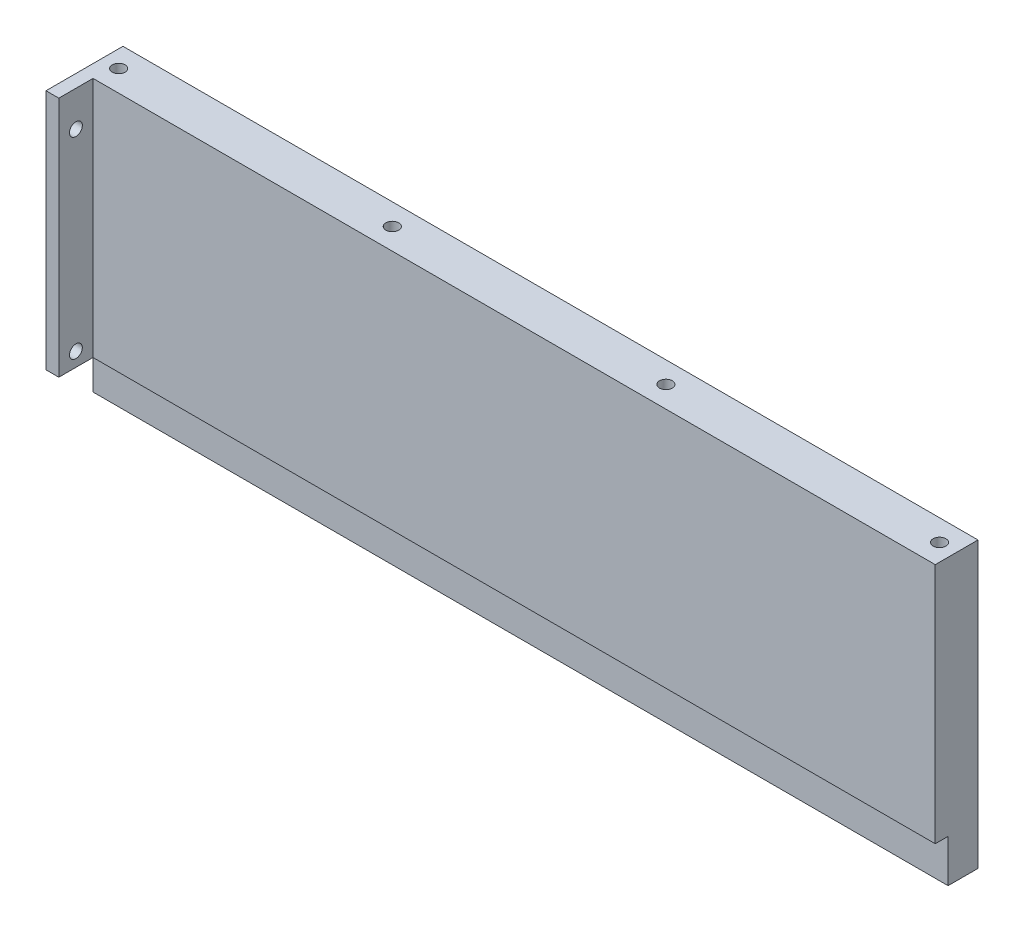
from build123d import *

# Parameters (mm, degrees)
SKETCH1_W           = 200
SKETCH1_H           = 10
BOSS_EXTRUDE1_DEPTH = 66.54
CUT_EXTRUDE1_REACH  = 122.219
SKETCH2_R           = 1.5
LPATTERN1_COUNT     = 4
LPATTERN1_PITCH     = 64
SKETCH3_W           = 200
SKETCH3_H           = 10
CUT_EXTRUDE2_DEPTH  = 3
SKETCH4_W           = 3
SKETCH4_H           = 56.54
BOSS_EXTRUDE2_DEPTH = 8
CUT_EXTRUDE3_REACH  = 213.179
SKETCH5_R           = 1.5


with BuildPart() as part:
    # Sketch1 → Boss-Extrude1 (new body)
    with BuildSketch(Plane(origin=(0, 0, 0), x_dir=(1, 0, 0), z_dir=(0, 1, 0))):
        Rectangle(SKETCH1_W, SKETCH1_H)
    extrude(amount=BOSS_EXTRUDE1_DEPTH)

    # Sketch2 → Cut-Extrude1 (cut, up to next)
    with BuildSketch(Plane(origin=(0, 66.54, 0), x_dir=(1, 0, 0), z_dir=(0, 1, 0)), mode=Mode.PRIVATE) as cut_extrude1_sk1:
        with Locations(Location((-96, 0, 0), (0, 0, 270))):
            Circle(SKETCH2_R)
    cut_extrude1_tool1 = extrude(cut_extrude1_sk1.sketch, amount=-CUT_EXTRUDE1_REACH, mode=Mode.PRIVATE) & part.part
    cut_extrude1 = cut_extrude1_tool1.solids().sort_by_distance((-96, 66.54, 0))[0]
    add(cut_extrude1, mode=Mode.SUBTRACT)

    # LPattern1: Cut-Extrude1 ×4
    with Locations(*[(i * LPATTERN1_PITCH, 0, 0) for i in range(1, LPATTERN1_COUNT)]):
        add(cut_extrude1, mode=Mode.SUBTRACT)

    # Sketch3 → Cut-Extrude2 (cut)
    with BuildSketch(Plane.XY.offset(5)):
        with Locations((0, 5)):
            Rectangle(SKETCH3_W, SKETCH3_H)
    extrude(amount=-CUT_EXTRUDE2_DEPTH, mode=Mode.SUBTRACT)

    # Sketch4 → Boss-Extrude2 (add)
    with BuildSketch(Plane.XY.offset(5)):
        with Locations((-98.5, 38.27)):
            Rectangle(SKETCH4_W, SKETCH4_H)
    extrude(amount=BOSS_EXTRUDE2_DEPTH)

    # Sketch5 → Cut-Extrude3 (cut, up to next)
    with BuildSketch(Plane.ZY.offset(100), mode=Mode.PRIVATE) as cut_extrude3_sk1:
        with Locations((9, 58.27)):
            Circle(SKETCH5_R)
    cut_extrude3_tool1 = extrude(cut_extrude3_sk1.sketch, amount=-CUT_EXTRUDE3_REACH, mode=Mode.PRIVATE) & part.part
    # Sketch5 → Cut-Extrude3 (cut, up to next)
    with BuildSketch(Plane.ZY.offset(100), mode=Mode.PRIVATE) as cut_extrude3_sk2:
        with Locations((9, 13.27)):
            Circle(SKETCH5_R)
    cut_extrude3_tool2 = extrude(cut_extrude3_sk2.sketch, amount=-CUT_EXTRUDE3_REACH, mode=Mode.PRIVATE) & part.part
    add(cut_extrude3_tool1.solids().sort_by_distance((-100, 58.27, 9))[0], mode=Mode.SUBTRACT)
    add(cut_extrude3_tool2.solids().sort_by_distance((-100, 13.27, 9))[0], mode=Mode.SUBTRACT)


solid = part.part
